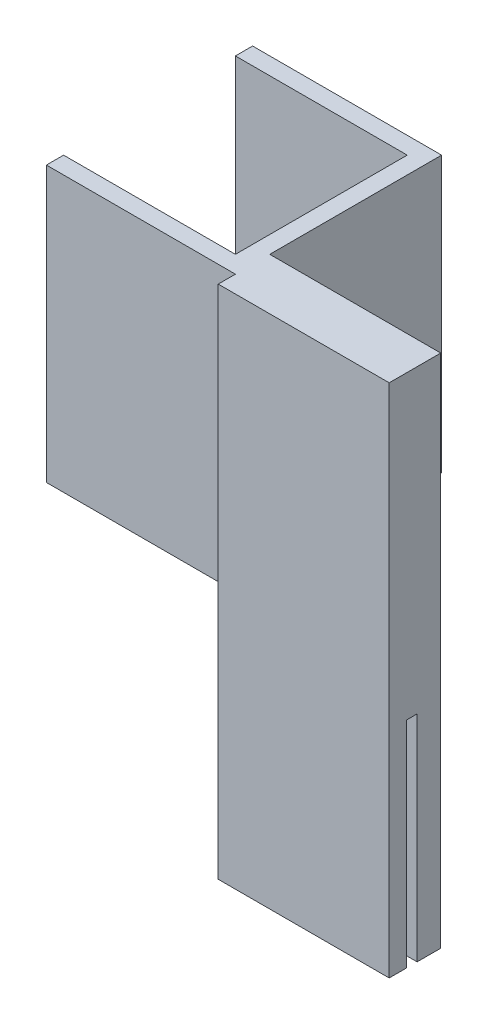
from build123d import *

# Parameters (mm, degrees)
EXTRUDE_THIN1_DEPTH      = 40.64
BOSS_EXTRUDE2_DEPTH      = 2.54
BOSS_EXTRUDE2_DEPTH_BACK = 5.08
SKETCH7_W                = 25.274399357
SKETCH7_H                = 76.2
SKETCH10_W               = 25.274399357
SKETCH10_H               = 1.587143393
CUT_EXTRUDE10_DEPTH      = 31.75


with BuildPart() as part:
    # Sketch1 → Extrude-Thin1 (new body)
    with BuildSketch(Plane(origin=(0, 0, 0), x_dir=(1, 0, 0), z_dir=(0, 1, 0))):
        Polygon((-25.4, 25.4), (0, 25.4), (0, 0), (-25.4, 0), (-25.4, -2.54), (2.54, -2.54), (2.54, 27.94), (-25.4, 27.94), align=None)
    extrude(amount=EXTRUDE_THIN1_DEPTH)

    # Sketch7 → Boss-Extrude2 (add, two sides: drawn at the far end of the back side and taken through both)
    with BuildSketch(Plane.XY.offset(2.54).offset(-BOSS_EXTRUDE2_DEPTH_BACK)):
        with Locations((15.177199679, 2.54)):
            Rectangle(SKETCH7_W, SKETCH7_H)
    extrude(amount=BOSS_EXTRUDE2_DEPTH + BOSS_EXTRUDE2_DEPTH_BACK)

    # Sketch10 → Cut-Extrude10 (cut)
    with BuildSketch(Plane.XZ.offset(35.56)):
        with Locations((15.177199679, 1.746428304)):
            Rectangle(SKETCH10_W, SKETCH10_H)
    extrude(amount=-CUT_EXTRUDE10_DEPTH, mode=Mode.SUBTRACT)


solid = part.part
